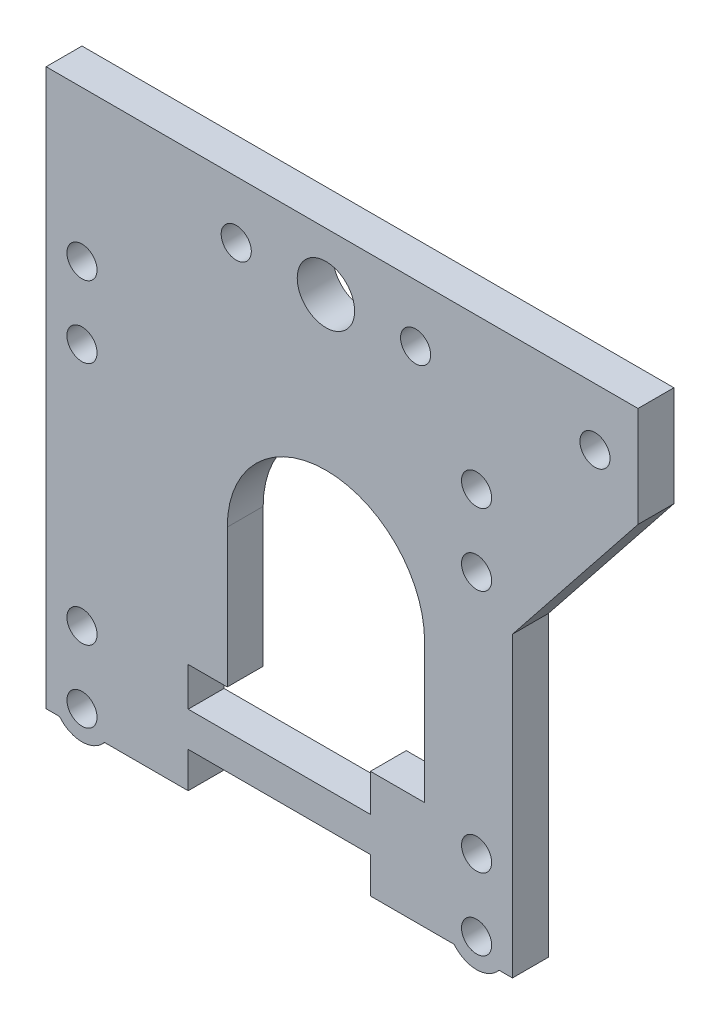
from build123d import *

# Parameters (mm, degrees)
SKETCH1_R           = 2.1
SKETCH1_W           = 25
SKETCH1_H           = 5.1
BOSS_EXTRUDE1_DEPTH = 5
CUT_EXTRUDE2_DEPTH  = 5
SKETCH4_R           = 2.1
SKETCH4_R_2         = 4
BOSS_EXTRUDE2_DEPTH = 5
SKETCH5_W           = 25.4
SKETCH5_H           = 5
SKETCH5_H_2         = 5.4
CUT_EXTRUDE3_DEPTH  = 10


with BuildPart() as part:
    # Sketch1 → Boss-Extrude1 (new body)
    with BuildSketch(Plane.XY):
        with BuildLine():
            Line((-65, 61.5), (0, 61.5))
            Line((0, 61.5), (0, 0))
            Line((0, 0), (-1.877501001, 0))
            ThreePointArc((-1.877501001, 0), (-5, -1.5), (-8.122498999, 0))
            Line((-8.122498999, 0), (-20, 0))
            Line((-20, 0), (-20, 5))
            Line((-20, 5), (-45, 5))
            Line((-45, 5), (-45, 0))
            Line((-45, 0), (-56.877501001, 0))
            ThreePointArc((-56.877501001, 0), (-60, -1.5), (-63.122498999, 0))
            Line((-63.122498999, 0), (-65, 0))
            Line((-65, 0), (-65, 61.5))
        make_face()
        with Locations((-60, 56.5)):
            Circle(SKETCH1_R, mode=Mode.SUBTRACT)
        with Locations((-5, 56.5)):
            Circle(SKETCH1_R, mode=Mode.SUBTRACT)
        with Locations((-60, 46.5)):
            Circle(SKETCH1_R, mode=Mode.SUBTRACT)
        with Locations((-5, 46.5)):
            Circle(SKETCH1_R, mode=Mode.SUBTRACT)
        with Locations(Location((-5, 12.5, 0), (0, 0, 180))):
            Circle(SKETCH1_R, mode=Mode.SUBTRACT)
        with Locations(Location((-5, 2.5, 0), (0, 0, 180))):
            Circle(SKETCH1_R, mode=Mode.SUBTRACT)
        with Locations(Location((-60, 2.5, 0), (0, 0, 180))):
            Circle(SKETCH1_R, mode=Mode.SUBTRACT)
        with Locations(Location((-60, 12.5, 0), (0, 0, 180))):
            Circle(SKETCH1_R, mode=Mode.SUBTRACT)
        with Locations((-32.5, 12.5)):
            Rectangle(SKETCH1_W, SKETCH1_H, mode=Mode.SUBTRACT)
    extrude(amount=BOSS_EXTRUDE1_DEPTH)

    # Sketch3 → Cut-Extrude2 (cut)
    with BuildSketch(Plane(origin=(0, 0, 0), x_dir=(-1, 0, 0), z_dir=(0, 0, -1))):
        with BuildLine():
            Line((39.75, 15.05), (39.75, 34.55))
            ThreePointArc((39.75, 34.55), (26, 48.3), (12.25, 34.55))
            Line((12.25, 34.55), (12.25, 15.05))
            Line((12.25, 15.05), (39.75, 15.05))
        make_face()
    extrude(amount=-CUT_EXTRUDE2_DEPTH, mode=Mode.SUBTRACT)

    # Sketch4 → Boss-Extrude2 (add)
    with BuildSketch(Plane(origin=(0, 0, 0), x_dir=(-1, 0, 0), z_dir=(0, 0, -1))):
        Polygon((0, 41.5), (-17.5, 63.5), (-17.5, 77.5), (65, 77.5), (65, 61.5), (0, 61.5), align=None)
        with Locations((-11.5, 69.5)):
            Circle(SKETCH4_R, mode=Mode.SUBTRACT)
        with Locations((13.5, 69.5)):
            Circle(SKETCH4_R, mode=Mode.SUBTRACT)
        with Locations((26, 69.5)):
            Circle(SKETCH4_R_2, mode=Mode.SUBTRACT)
        with Locations((38.5, 69.5)):
            Circle(SKETCH4_R, mode=Mode.SUBTRACT)
    extrude(amount=-BOSS_EXTRUDE2_DEPTH)

    # Sketch5 → Cut-Extrude3 (cut)
    with BuildSketch(Plane(origin=(0, 0, 0), x_dir=(-1, 0, 0), z_dir=(0, 0, -1))):
        with Locations((32.5, 2.5)):
            Rectangle(SKETCH5_W, SKETCH5_H)
        with Locations((32.5, 12.55)):
            Rectangle(SKETCH5_W, SKETCH5_H_2)
    extrude(amount=-CUT_EXTRUDE3_DEPTH, mode=Mode.SUBTRACT)


solid = part.part
